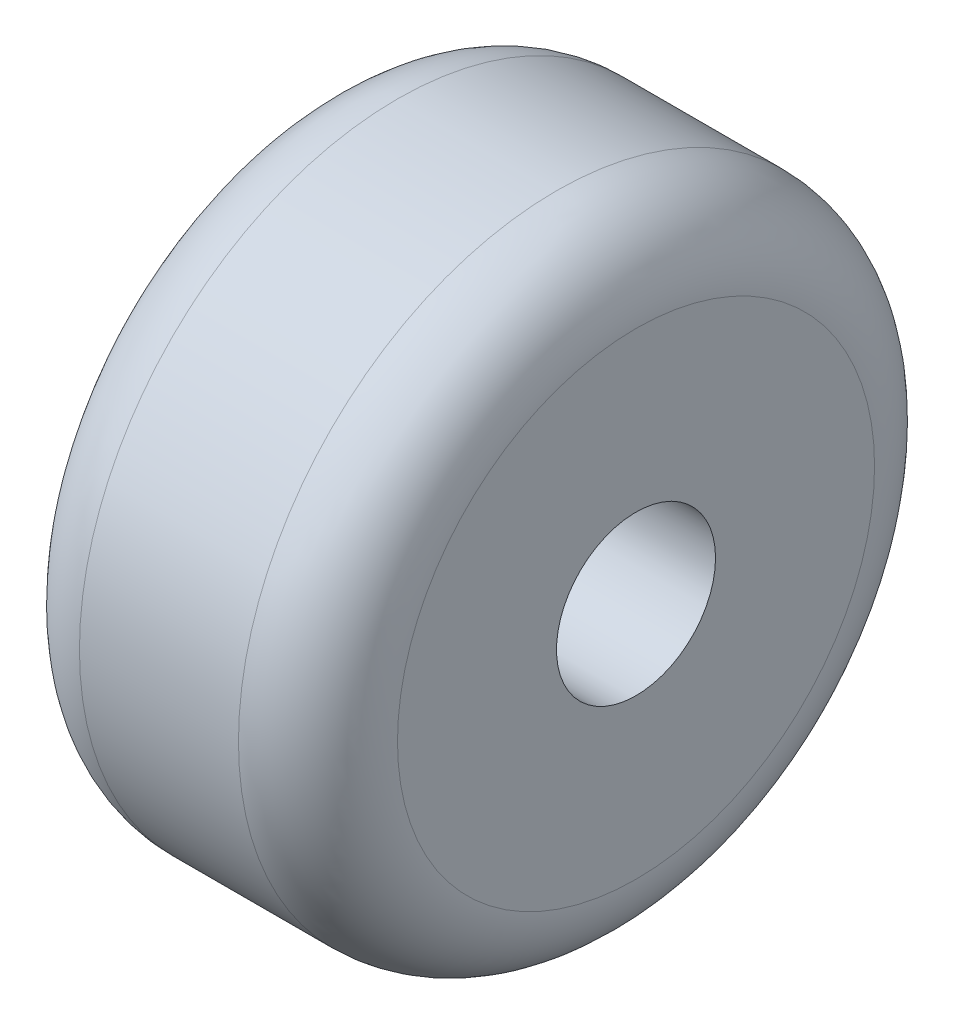
from build123d import *

# Parameters (mm, degrees)
SKETCH2_R           = 25.4
BOSS_EXTRUDE1_DEPTH = 25.4
FILLET1_R           = 6.35
SKETCH3_R           = 6.35
CUT_EXTRUDE1_DEPTH  = 25.4


with BuildPart() as part:
    # Sketch2 → Boss-Extrude1 (new body)
    with BuildSketch(Plane(origin=(0, 0, 0), x_dir=(0, 0, -1), z_dir=(1, 0, 0))):
        Circle(SKETCH2_R)
    extrude(amount=BOSS_EXTRUDE1_DEPTH)

    # Fillet1
    fillet1_edges = [part.edges().sort_by_distance(p)[0] for p in [
        (0, 0, 25.4),
        (25.4, 0, 25.4),
    ]]
    fillet(fillet1_edges, radius=FILLET1_R)

    # Sketch3 → Cut-Extrude1 (cut)
    with BuildSketch(Plane(origin=(25.4, 0, 0), x_dir=(0, 0, -1), z_dir=(1, 0, 0))):
        Circle(SKETCH3_R)
    extrude(amount=-CUT_EXTRUDE1_DEPTH, mode=Mode.SUBTRACT)


solid = part.part
